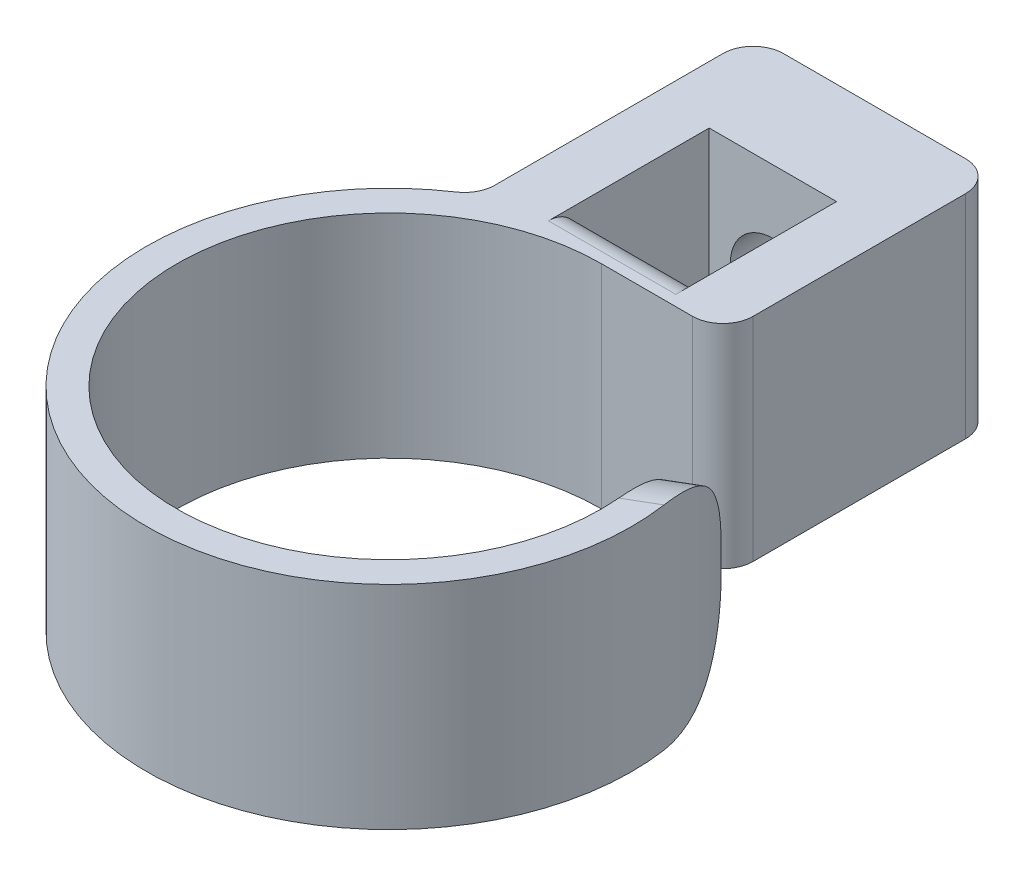
from build123d import *

# Parameters (mm, degrees)
SKETCH1_W           = 4.2
SKETCH1_H           = 4.3
BOSS_EXTRUDE1_DEPTH = 7
FILLET1_R           = 1
FILLET2_R           = 3
FILLET3_R           = 1
SKETCH3_W           = 8
SKETCH3_H           = 7
BOSS_EXTRUDE2_DEPTH = 2
SKETCH2_R           = 1.4
CUT_EXTRUDE2_DEPTH  = 4
FILLET4_R           = 1


with BuildPart() as part:
    # Sketch1 → Boss-Extrude1 (new body)
    # profile 1 of 2: a face of its own
    with BuildSketch(Plane(origin=(0, 0, 0), x_dir=(1, 0, 0), z_dir=(0, 1, 0))):
        with BuildLine():
            ThreePointArc((7, 0), (-4.949747468, -4.949747468), (0, 7))
            Line((0, 7), (3.872983346, 7))
            Line((3.872983346, 7), (4, 7))
            Line((4, 7), (4, 14))
            Line((4, 14), (-4, 14))
            Line((-4, 14), (-4, 7))
            Line((-4, 7), (-3.872983346, 7))
            ThreePointArc((-3.872983346, 7), (-3.936655355, 6.964391188), (-4, 6.92820323))
            ThreePointArc((-4, 6.92820323), (-2.053343481, -7.73199719), (6.910323964, 4.030809189))
            Line((6.910323964, 4.030809189), (6.046533468, 3.52695804))
            ThreePointArc((6.046533468, 3.52695804), (6.757430513, 1.826782105), (7, 0))
        make_face()
        with Locations((0, 10.5)):
            Rectangle(SKETCH1_W, SKETCH1_H, mode=Mode.SUBTRACT)
    # profile 2 of 2: a face of its own
    with BuildSketch(Plane(origin=(0, 0, 0), x_dir=(1, 0, 0), z_dir=(0, 1, 0))):
        with BuildLine():
            Line((-4, 7), (-4, 6.92820323))
            ThreePointArc((-4, 6.92820323), (-3.936655355, 6.964391188), (-3.872983346, 7))
            Line((-3.872983346, 7), (-4, 7))
        make_face()
    extrude(amount=BOSS_EXTRUDE1_DEPTH)

    # Fillet1
    fillet1_edges = [part.edges().sort_by_distance(p)[0] for p in [
        (4, 3.5, -7),
        (-4, 3.5, -6.92820323),
    ]]
    fillet(fillet1_edges, radius=FILLET1_R)

    # Fillet2
    fillet2_edges = [part.edges().sort_by_distance(p)[0] for p in [
        (6.478428716, 0, -3.778883614),
        (6.478428716, 7, -3.778883614),
    ]]
    fillet(fillet2_edges, radius=FILLET2_R)

    # Fillet3
    fillet3_edges = [part.edges().sort_by_distance(p)[0] for p in [
        (0, 7, -8.35),
        (0, 0, -8.35),
    ]]
    fillet(fillet3_edges, radius=FILLET3_R)

    # Sketch3 → Boss-Extrude2 (add)
    with BuildSketch(Plane(origin=(0, 0, -14), x_dir=(-1, 0, 0), z_dir=(0, 0, -1))):
        with Locations((0, 3.5)):
            Rectangle(SKETCH3_W, SKETCH3_H)
    extrude(amount=BOSS_EXTRUDE2_DEPTH)

    # Sketch2 → Cut-Extrude2 (cut)
    with BuildSketch(Plane(origin=(0, 0, -16), x_dir=(-1, 0, 0), z_dir=(0, 0, -1))):
        with Locations((0, 3.5)):
            Circle(SKETCH2_R)
    extrude(amount=-CUT_EXTRUDE2_DEPTH, mode=Mode.SUBTRACT)

    # Fillet4
    fillet4_edges = [part.edges().sort_by_distance(p)[0] for p in [
        (4, 3.5, -16),
        (-4, 3.5, -16),
    ]]
    fillet(fillet4_edges, radius=FILLET4_R)


solid = part.part
